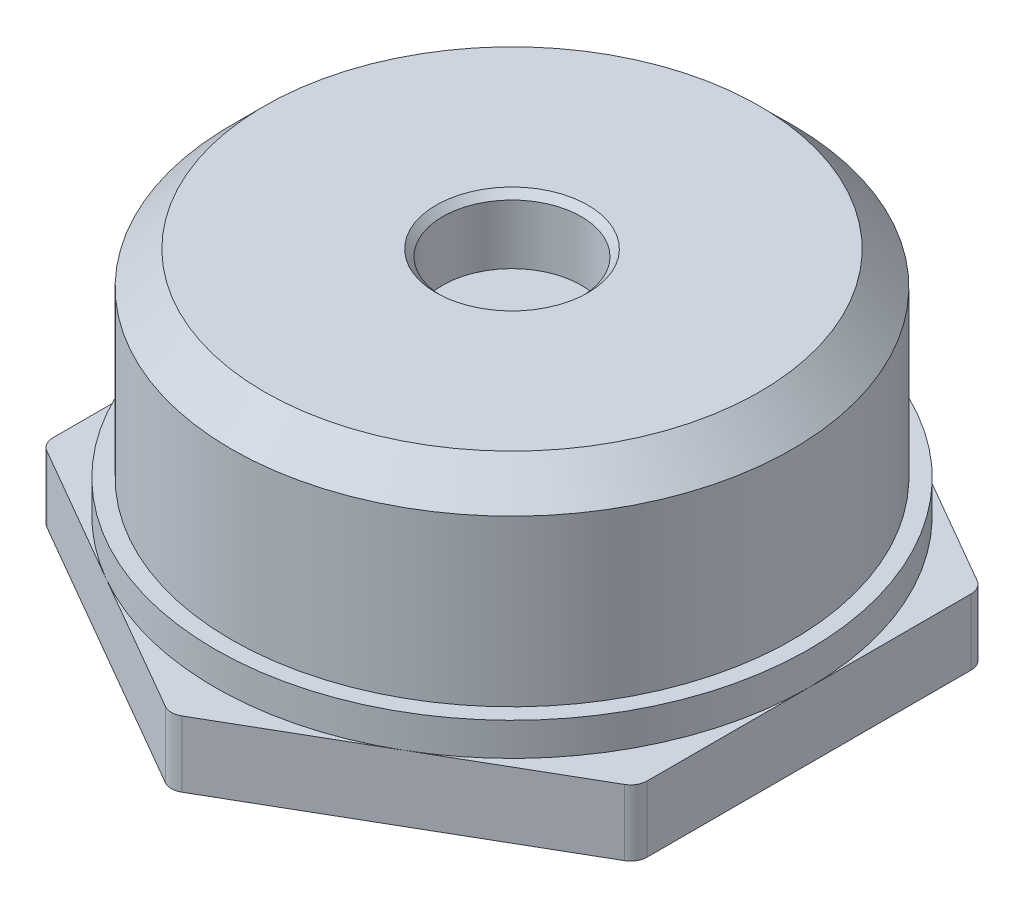
from build123d import *

# Parameters (mm, degrees)
BOSS_EXTRUDE1_DEPTH      = 2
FILLET1_R                = 0.5
SKETCH2_R                = 9
BOSS_EXTRUDE2_DEPTH      = 1
SKETCH3_R                = 8.5
BOSS_EXTRUDE3_DEPTH      = 4
CUT_EXTRUDE1_DEPTH       = 16.375249198
BOSS_EXTRUDE4_DEPTH      = 1
BOSS_EXTRUDE4_DEPTH_BACK = 1
SKETCH5_R                = 8.5
SKETCH6_R                = 8.5
BOSS_EXTRUDE5_DEPTH      = 1
CHAMFER2_SIZE            = 1
SKETCH7_R                = 2.1
CUT_EXTRUDE2_DEPTH       = 2
CHAMFER3_SIZE            = 0.2


with BuildPart() as part:
    # Sketch1 → Boss-Extrude1 (new body)
    with BuildSketch(Plane(origin=(0, 31, 0), x_dir=(1, 0, 0), z_dir=(0, 1, 0))):
        Polygon((0, 10.392304845), (-9, 5.196152423), (-9, -5.196152423), (0, -10.392304845), (9, -5.196152423), (9, 5.196152423), align=None)
    extrude(amount=BOSS_EXTRUDE1_DEPTH)

    # Fillet1
    fillet1_edges = [part.edges().sort_by_distance(p)[0] for p in [
        (9, 32, -5.196152423),
        (9, 32, 5.196152423),
        (0, 32, 10.392304845),
        (-9, 32, 5.196152423),
        (-9, 32, -5.196152423),
        (0, 32, -10.392304845),
    ]]
    fillet(fillet1_edges, radius=FILLET1_R)

    # Sketch2 → Boss-Extrude2 (add)
    with BuildSketch(Plane(origin=(0, 33, 0), x_dir=(1, 0, 0), z_dir=(0, 1, 0))):
        with Locations(Location((0, 0, 0), (0, 0, 60))):
            Circle(SKETCH2_R)
    extrude(amount=BOSS_EXTRUDE2_DEPTH)

    # Sketch3 → Boss-Extrude3 (add)
    with BuildSketch(Plane(origin=(0, 34, 0), x_dir=(1, 0, 0), z_dir=(0, 1, 0))):
        with Locations(Location((0, 0, 0), (0, 0, 270))):
            Circle(SKETCH3_R)
    extrude(amount=BOSS_EXTRUDE3_DEPTH)

    # Sketch4 → Cut-Extrude1 (cut, through all)
    with BuildSketch(Plane(origin=(0, 38, 0), x_dir=(1, 0, 0), z_dir=(0, 1, 0))):
        Polygon((0, 2.886751346), (-2.5, 1.443375673), (-2.5, -1.443375673), (0, -2.886751346), (2.5, -1.443375673), (2.5, 1.443375673), align=None)
    extrude(amount=-CUT_EXTRUDE1_DEPTH, mode=Mode.SUBTRACT)

    # Sketch5 → Boss-Extrude4 (add, two sides: drawn at the far end of the back side and taken through both)
    with BuildSketch(Plane(origin=(0, 38, 0), x_dir=(1, 0, 0), z_dir=(0, 1, 0)).offset(-BOSS_EXTRUDE4_DEPTH_BACK)):
        with Locations(Location((0, 0, 0), (0, 0, 270))):
            Circle(SKETCH5_R)
    extrude(amount=BOSS_EXTRUDE4_DEPTH + BOSS_EXTRUDE4_DEPTH_BACK)

    # Sketch6 → Boss-Extrude5 (add)
    with BuildSketch(Plane(origin=(0, 39, 0), x_dir=(1, 0, 0), z_dir=(0, 1, 0))):
        with Locations(Location((0, 0, 0), (0, 0, 270))):
            Circle(SKETCH6_R)
    extrude(amount=BOSS_EXTRUDE5_DEPTH)

    # Chamfer2
    chamfer2_edges = [part.edges().sort_by_distance(p)[0] for p in [
        (0, 40, -8.5),
    ]]
    chamfer(chamfer2_edges, length=CHAMFER2_SIZE)

    # Sketch7 → Cut-Extrude2 (cut)
    with BuildSketch(Plane(origin=(0, 40, 0), x_dir=(1, 0, 0), z_dir=(0, 1, 0))):
        with Locations(Location((0, 0, 0), (0, 0, 270))):
            Circle(SKETCH7_R)
    extrude(amount=-CUT_EXTRUDE2_DEPTH, mode=Mode.SUBTRACT)

    # Chamfer3
    chamfer3_edges = [part.edges().sort_by_distance(p)[0] for p in [
        (0, 40, -2.1),
    ]]
    chamfer(chamfer3_edges, length=CHAMFER3_SIZE)


solid = part.part
